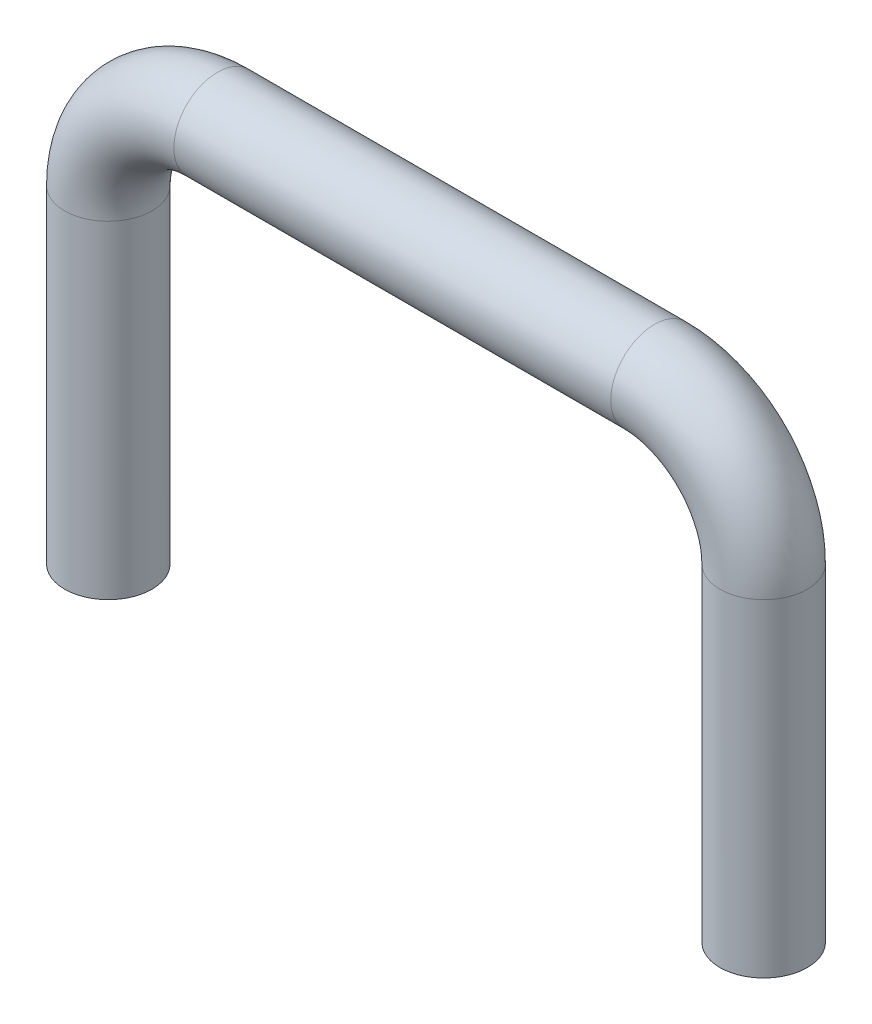
from build123d import *

# Parameters (mm, degrees)
CROQUIS2_R = 2


with BuildPart() as part:
    # Barrer1: sweep along a path in Croquis1
    with BuildLine(Plane.XY) as barrer1_path:
        Line((-15, 0), (-15, 15))
        ThreePointArc((-15, 15), (-13.535533906, 18.535533906), (-10, 20))
        Line((-10, 20), (10, 20))
        ThreePointArc((10, 20), (13.535533906, 18.535533906), (15, 15))
        Line((15, 15), (15, 0))
    # Croquis2 → Barrer1 (sweep)
    with BuildSketch(Plane(origin=(0, 0, 0), x_dir=(1, 0, 0), z_dir=(0, 1, 0))):
        with Locations((-15, 0)):
            Circle(CROQUIS2_R)
    sweep(path=barrer1_path.line)


solid = part.part
